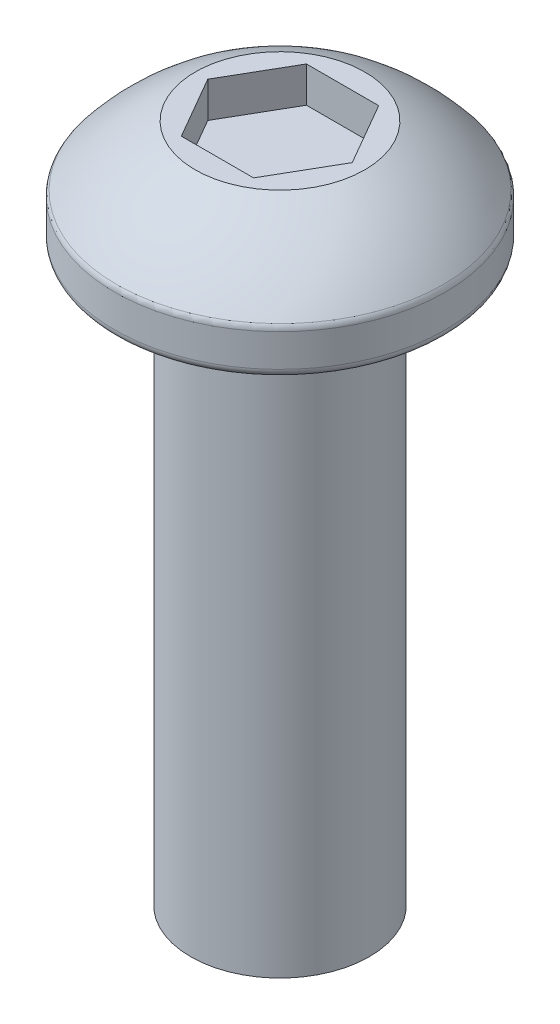
from build123d import *

# Parameters (mm, degrees)
CUT_EXTRUDE1_START      = 2
CUT_EXTRUDE1_DEPTH      = 3
FILLET1_R               = 0.25
CUT_EXTRUDE2_DEPTH      = 18.285290042
CUT_EXTRUDE2_DEPTH_BACK = 18.285290042
SKETCH4_W               = 9.25
SKETCH4_H               = 2


with BuildPart() as part:
    # Sketch2 → Revolve1 (revolve)
    with BuildSketch(Plane.XY, mode=Mode.PRIVATE) as revolve1_sk:
        with BuildLine():
            Line((2.5, -16), (2.5, -7.698851501))
            ThreePointArc((2.5, -7.698851501), (1.280768103, -8.115724939), (0, -8.256944444))
            Line((0, -8.256944444), (0, -16))
            Line((0, -16), (2.5, -16))
        make_face()
        with BuildLine():
            Line((2.5, 0), (4.625, 0))
            Line((4.625, 0), (4.625, 1.25))
            ThreePointArc((4.625, 1.25), (2.571630076, 2.907656268), (0, 3.5))
            Line((0, 3.5), (0, -8.256944444))
            ThreePointArc((0, -8.256944444), (1.280768103, -8.115724939), (2.5, -7.698851501))
            Line((2.5, -7.698851501), (2.5, 0))
        make_face()
    revolve(revolve1_sk.sketch.rotate(Axis((0, 21.322324325, 0), (0, -1, 0)), 180), axis=Axis((0, 21.322324325, 0), (0, -1, 0)))

    # Sketch3 → Cut-Extrude1 (cut)
    with BuildSketch(Plane(origin=(0, 0, 0), x_dir=(1, 0, 0), z_dir=(0, 1, 0)).offset(CUT_EXTRUDE1_START)):
        Polygon((2.020725942, 0), (1.010362971, 1.75), (-1.010362971, 1.75), (-2.020725942, 0), (-1.010362971, -1.75), (1.010362971, -1.75), align=None)
    extrude(amount=CUT_EXTRUDE1_DEPTH, mode=Mode.SUBTRACT)

    # Fillet1
    fillet1_edges = [part.edges().sort_by_distance(p)[0] for p in [
        (4.625, 1.25, 0),
        (4.625, 0, 0),
        (2.5, 0, 0),
    ]]
    fillet(fillet1_edges, radius=FILLET1_R)

    # Sketch4 → Cut-Extrude2 (cut, two sides: drawn at the far end of the back side and taken through both)
    with BuildSketch(Plane.XY.offset(-CUT_EXTRUDE2_DEPTH_BACK)):
        with Locations((0, 4)):
            Rectangle(SKETCH4_W, SKETCH4_H)
    extrude(amount=CUT_EXTRUDE2_DEPTH + CUT_EXTRUDE2_DEPTH_BACK, mode=Mode.SUBTRACT)


solid = part.part
